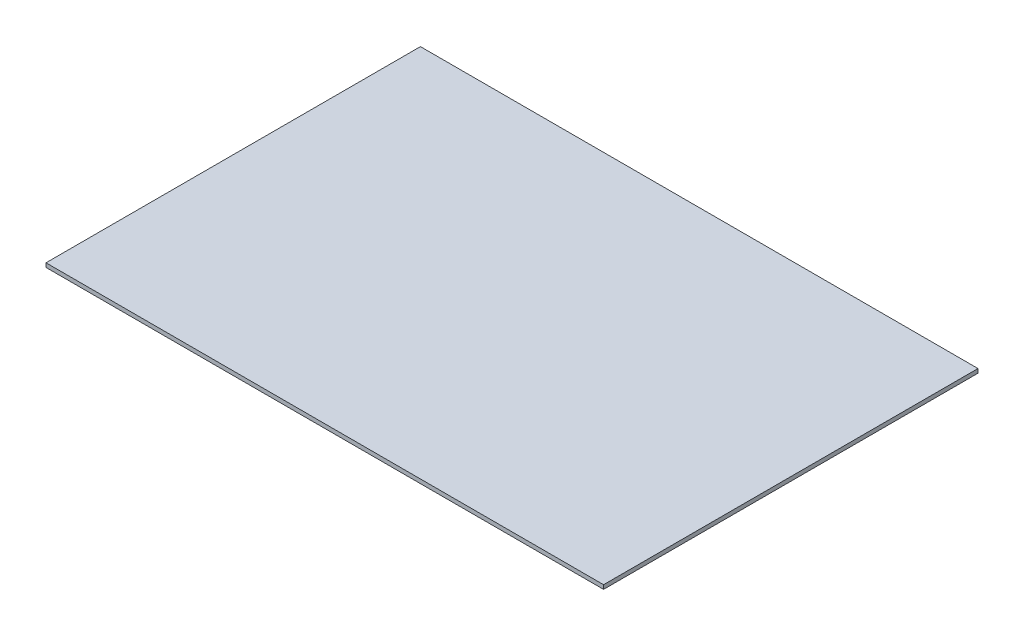
from build123d import *

# Parameters (mm, degrees)
SKETCH2_W           = 274
SKETCH2_H           = 184
BOSS_EXTRUDE1_DEPTH = 1


with BuildPart() as part:
    # Sketch2 → Boss-Extrude1 (new, symmetric)
    with BuildSketch(Plane(origin=(0, 0, 0), x_dir=(1, 0, 0), z_dir=(0, 1, 0))):
        Rectangle(SKETCH2_W, SKETCH2_H)
    extrude(amount=BOSS_EXTRUDE1_DEPTH, both=True)


solid = part.part
